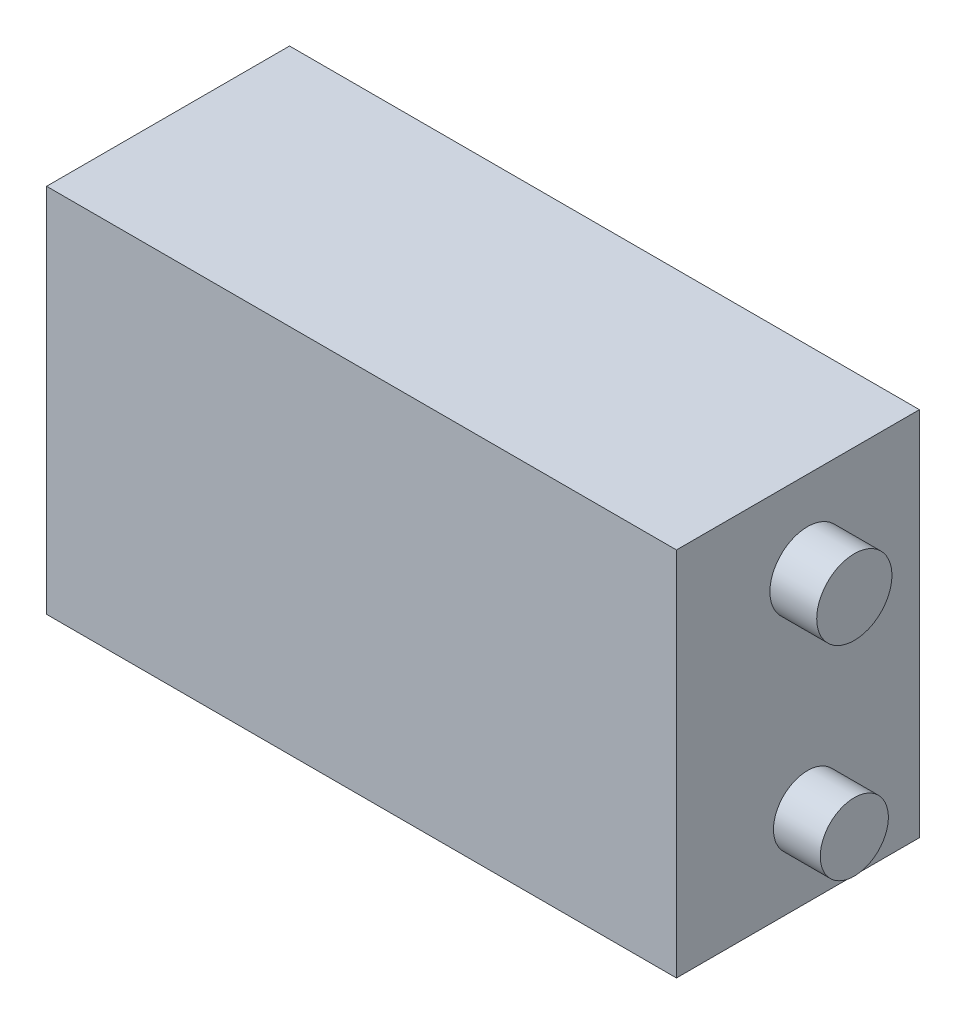
from build123d import *

# Parameters (mm, degrees)
SKETCH1_W           = 44.45
SKETCH1_H           = 26.162
BOSS_EXTRUDE1_DEPTH = 17.145
SKETCH2_R           = 2.653013258
SKETCH2_R_2         = 2.40141023
BOSS_EXTRUDE2_DEPTH = 3.302


with BuildPart() as part:
    # Sketch1 → Boss-Extrude1 (new body)
    with BuildSketch(Plane.XY):
        Rectangle(SKETCH1_W, SKETCH1_H)
    extrude(amount=BOSS_EXTRUDE1_DEPTH)

    # Sketch2 → Boss-Extrude2 (add)
    with BuildSketch(Plane(origin=(22.225, 0, 0), x_dir=(0, 0, -1), z_dir=(1, 0, 0))):
        with Locations(Location((-7.896848557, 7.227034624, 0), (0, 0, 180))):
            Circle(SKETCH2_R)
        with Locations(Location((-7.896848557, -7.428836292, 0), (0, 0, 180))):
            Circle(SKETCH2_R_2)
    extrude(amount=BOSS_EXTRUDE2_DEPTH)


solid = part.part
